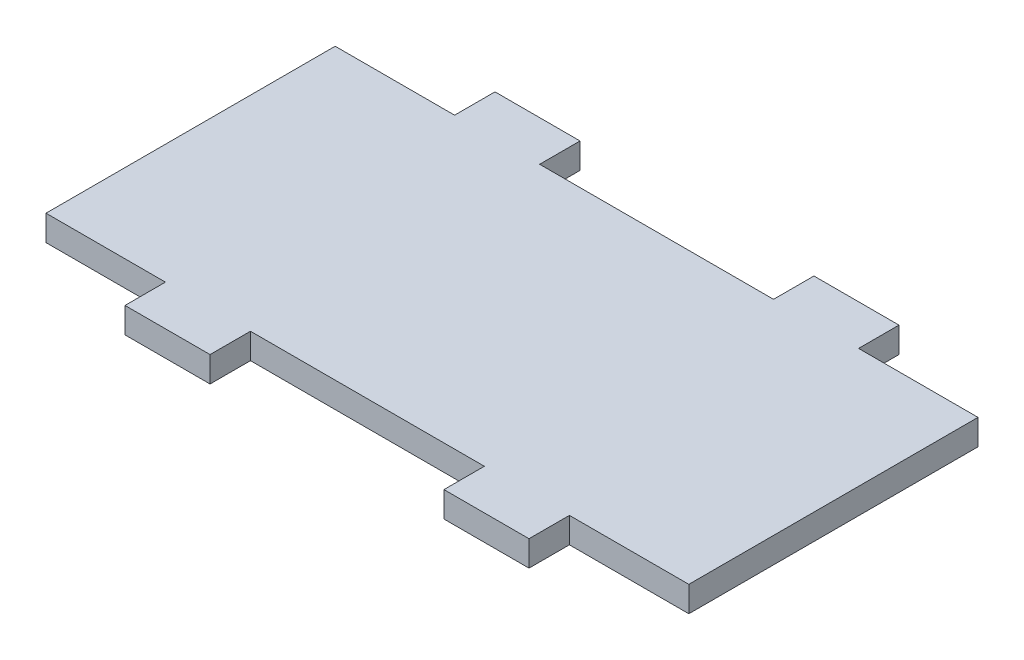
from build123d import *

# Parameters (mm, degrees)
BOSS_EXTRUDE1_DEPTH = 3


with BuildPart() as part:
    # Sketch1 → Boss-Extrude1 (new body)
    with BuildSketch(Plane(origin=(0, 0, 0), x_dir=(1, 0, 0), z_dir=(0, 1, 0))):
        Polygon((37.79, -17), (23.75, -17), (23.75, -21.75), (13.75, -21.75), (13.75, -17), (-13.75, -17), (-13.75, -21.75), (-23.75, -21.75), (-23.75, -17), (-37.79, -17), (-37.79, 17), (-23.75, 17), (-23.75, 21.75), (-13.75, 21.75), (-13.75, 17), (13.75, 17), (13.75, 21.75), (23.75, 21.75), (23.75, 17), (37.79, 17), align=None)
    extrude(amount=BOSS_EXTRUDE1_DEPTH)


solid = part.part
